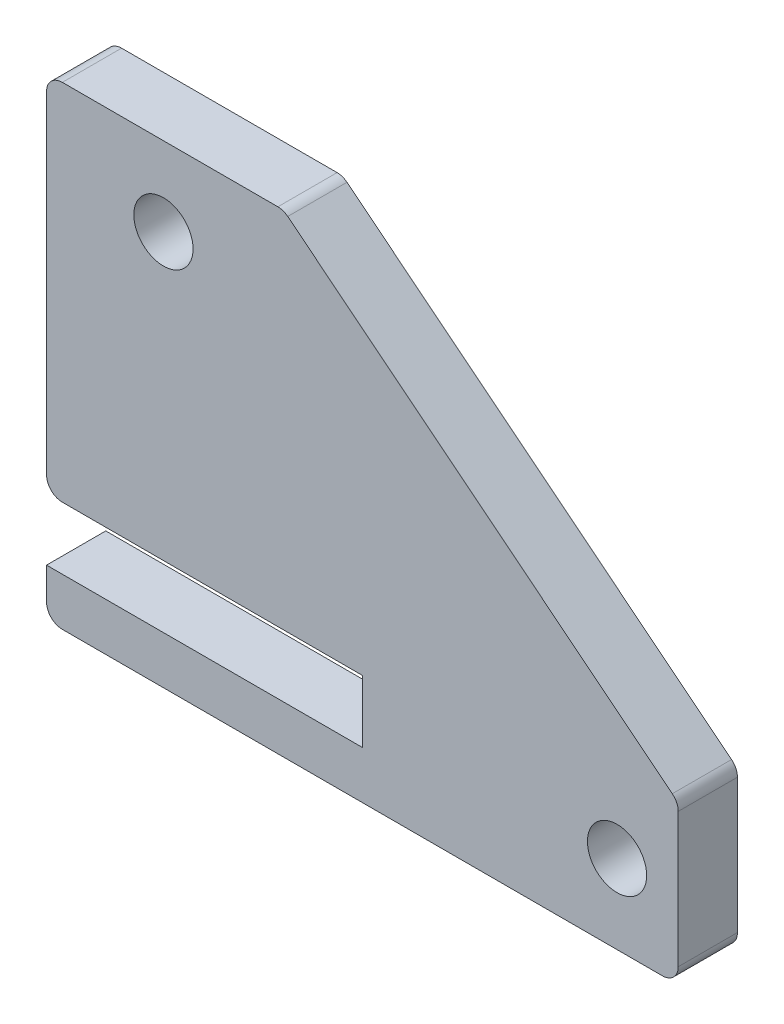
from build123d import *

# Parameters (mm, degrees)
SKETCH1_W           = 50.8
SKETCH1_H           = 25.4
BOSS_EXTRUDE1_DEPTH = 2.38125
SKETCH2_R           = 2.38125
CUT_EXTRUDE1_DEPTH  = 41.937805342
SKETCH3_R           = 2.38125
CUT_EXTRUDE2_DEPTH  = 41.937805342
CUT_EXTRUDE3_DEPTH  = 41.937805342
FILLET1_R           = 1.27


with BuildPart() as part:
    # Sketch1 → Boss-Extrude1 (new, symmetric)
    with BuildSketch(Plane.XY):
        with Locations((0, 19.05)):
            Rectangle(SKETCH1_W, SKETCH1_H)
        Polygon((25.4, 0), (0, 0), (0, -2.50825), (-25.4, -2.50825), (-25.4, -6.35), (25.4, -6.35), align=None)
        Polygon((-25.4, 6.35), (-25.4, 2.50825), (0, 2.50825), (0, 0), (25.4, 0), (25.4, 6.35), align=None)
    extrude(amount=BOSS_EXTRUDE1_DEPTH, both=True)

    # Sketch2 → Cut-Extrude1 (cut, through all)
    with BuildSketch(Plane.XY.offset(2.38125)):
        with Locations((20.47875, 0)):
            Circle(SKETCH2_R)
    extrude(amount=-CUT_EXTRUDE1_DEPTH, mode=Mode.SUBTRACT)

    # Sketch3 → Cut-Extrude2 (cut, through all)
    with BuildSketch(Plane.XY.offset(2.38125)):
        with Locations((-15.999222806, 25.4)):
            Circle(SKETCH3_R)
    extrude(amount=-CUT_EXTRUDE2_DEPTH, mode=Mode.SUBTRACT)

    # Sketch4 → Cut-Extrude3 (cut, through all)
    with BuildSketch(Plane.XY.offset(2.38125)):
        Polygon((-6.35, 31.75), (25.4, 6.35), (25.4, 31.75), align=None)
    extrude(amount=-CUT_EXTRUDE3_DEPTH, mode=Mode.SUBTRACT)

    # Fillet1
    fillet1_edges = [part.edges().sort_by_distance(p)[0] for p in [
        (-25.4, 31.75, 0),
        (25.4, -6.35, 0),
        (-25.4, -6.35, 0),
        (-25.4, 2.50825, 0),
        (-6.35, 31.75, 0),
        (25.4, 6.35, 0),
    ]]
    fillet(fillet1_edges, radius=FILLET1_R)


solid = part.part
